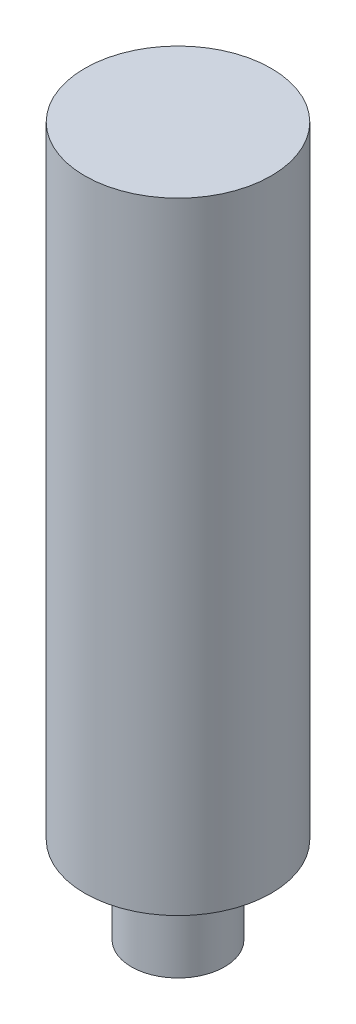
from build123d import *

# Parameters (mm, degrees)
SKETCH_1_R      = 1.5
EXTRUDE_1_DEPTH = 2.8
SKETCH_2_R      = 3
EXTRUDE_2_DEPTH = 20


with BuildPart() as part:
    # 草圖1 → 填料-伸長1 (new body)
    with BuildSketch(Plane(origin=(0, 0, 0), x_dir=(1, 0, 0), z_dir=(0, 1, 0))):
        with Locations(Location((0, 0, 0), (0, 0, 270))):
            Circle(SKETCH_1_R)
    extrude(amount=EXTRUDE_1_DEPTH)

    # 草圖2 → 填料-伸長2 (add)
    with BuildSketch(Plane(origin=(0, 2.8, 0), x_dir=(1, 0, 0), z_dir=(0, 1, 0))):
        with Locations(Location((0, 0, 0), (0, 0, 270))):
            Circle(SKETCH_2_R)
    extrude(amount=EXTRUDE_2_DEPTH)


solid = part.part
